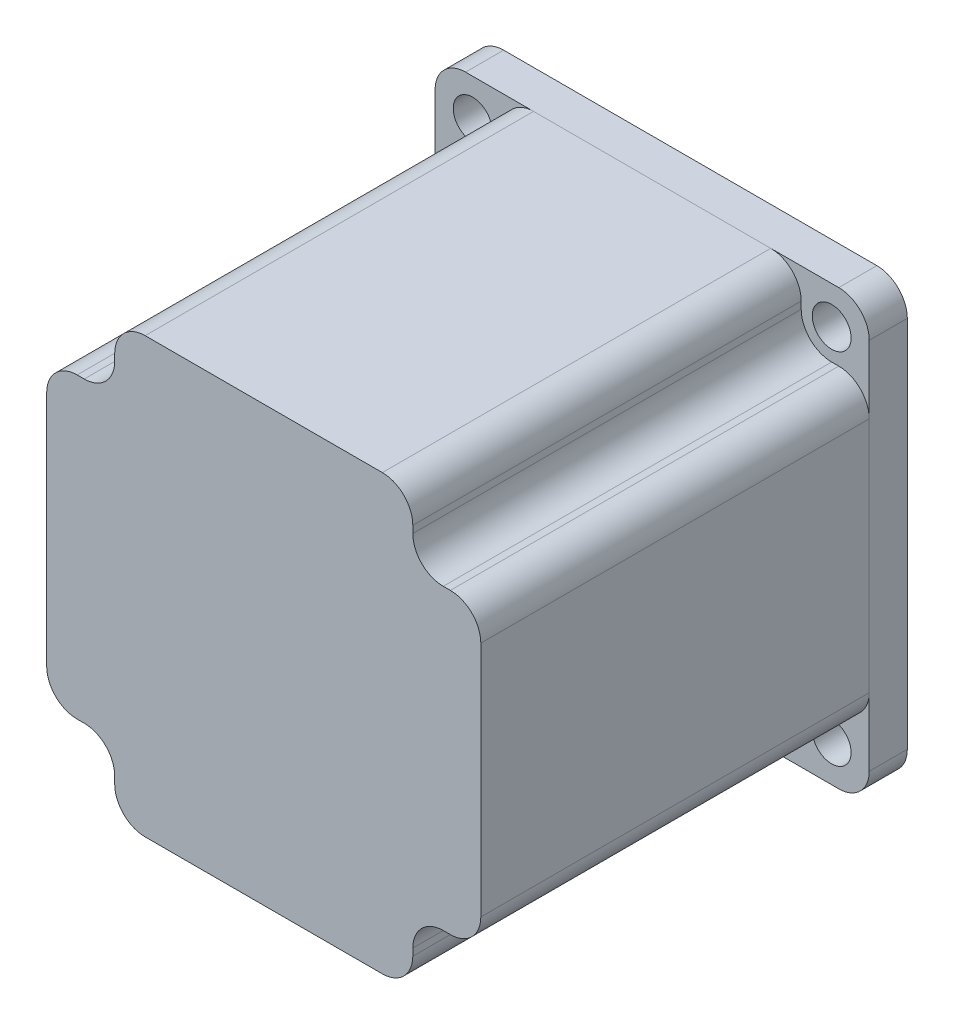
from build123d import *

# Parameters (mm, degrees)
BOSS_EXTRUDE1_DEPTH = 5
BOSS_EXTRUDE2_DEPTH = 51


with BuildPart() as part:
    # Sketch2 → Boss-Extrude1 (new body)
    with BuildSketch(Plane.XY):
        with BuildLine():
            Line((24.5, 28.5), (-24.5, 28.5))
            ThreePointArc((-24.5, 28.5), (-27.328427125, 27.328427125), (-28.5, 24.5))
            Line((-28.5, 24.5), (-28.5, 16.956333897))
            Line((-28.5, 16.956333897), (-28.5, 14.868769462))
            Line((-28.5, 14.868769462), (-28.5, 12.443898331))
            Line((-28.5, 12.443898331), (-28.5, 10.356333897))
            Line((-28.5, 10.356333897), (-28.5, -10.356333897))
            Line((-28.5, -10.356333897), (-28.5, -12.443898331))
            Line((-28.5, -12.443898331), (-28.5, -14.868769462))
            Line((-28.5, -14.868769462), (-28.5, -16.956333897))
            Line((-28.5, -16.956333897), (-28.5, -24.5))
            ThreePointArc((-28.5, -24.5), (-27.328427125, -27.328427125), (-24.5, -28.5))
            Line((-24.5, -28.5), (24.5, -28.5))
            ThreePointArc((24.5, -28.5), (27.328427125, -27.328427125), (28.5, -24.5))
            Line((28.5, -24.5), (28.5, -16.956333897))
            Line((28.5, -16.956333897), (28.5, -14.868769462))
            Line((28.5, -14.868769462), (28.5, -12.443898331))
            Line((28.5, -12.443898331), (28.5, -10.356333897))
            Line((28.5, -10.356333897), (28.5, 10.356333897))
            Line((28.5, 10.356333897), (28.5, 12.443898331))
            Line((28.5, 12.443898331), (28.5, 14.868769462))
            Line((28.5, 14.868769462), (28.5, 16.956333897))
            Line((28.5, 16.956333897), (28.5, 24.5))
            ThreePointArc((28.5, 24.5), (27.328427125, 27.328427125), (24.5, 28.5))
        make_face()
        with BuildLine():
            ThreePointArc((26.12, -23.57), (23.57, -21.02), (21.02, -23.57))
            ThreePointArc((21.02, -23.57), (23.57, -26.12), (26.12, -23.57))
        make_face(mode=Mode.SUBTRACT)
        with BuildLine():
            ThreePointArc((26.12, 23.57), (23.57, 26.12), (21.02, 23.57))
            ThreePointArc((21.02, 23.57), (23.57, 21.02), (26.12, 23.57))
        make_face(mode=Mode.SUBTRACT)
        with BuildLine():
            ThreePointArc((-21.02, 23.57), (-23.57, 26.12), (-26.12, 23.57))
            ThreePointArc((-26.12, 23.57), (-23.57, 21.02), (-21.02, 23.57))
        make_face(mode=Mode.SUBTRACT)
        with BuildLine():
            ThreePointArc((-21.02, -23.57), (-23.57, -21.02), (-26.12, -23.57))
            ThreePointArc((-26.12, -23.57), (-23.57, -26.12), (-21.02, -23.57))
        make_face(mode=Mode.SUBTRACT)
    extrude(amount=-BOSS_EXTRUDE1_DEPTH)


with BuildPart() as body_2:
    # Sketch3 → Boss-Extrude2 (new body)
    with BuildSketch(Plane.XY):
        with BuildLine():
            Line((-15.57, -28.5), (15.57, -28.5))
            ThreePointArc((15.57, -28.5), (18.398427125, -27.328427125), (19.57, -24.5))
            Line((19.57, -24.5), (19.57, -23.57))
            ThreePointArc((19.57, -23.57), (20.741572875, -20.741572875), (23.57, -19.57))
            Line((23.57, -19.57), (24.5, -19.57))
            ThreePointArc((24.5, -19.57), (27.328427125, -18.398427125), (28.5, -15.57))
            Line((28.5, -15.57), (28.5, 15.57))
            ThreePointArc((28.5, 15.57), (27.328427125, 18.398427125), (24.5, 19.57))
            Line((24.5, 19.57), (23.57, 19.57))
            ThreePointArc((23.57, 19.57), (20.741572875, 20.741572875), (19.57, 23.57))
            Line((19.57, 23.57), (19.57, 24.5))
            ThreePointArc((19.57, 24.5), (18.398427125, 27.328427125), (15.57, 28.5))
            Line((15.57, 28.5), (-15.57, 28.5))
            ThreePointArc((-15.57, 28.5), (-18.398427125, 27.328427125), (-19.57, 24.5))
            Line((-19.57, 24.5), (-19.57, 23.57))
            ThreePointArc((-19.57, 23.57), (-20.741572875, 20.741572875), (-23.57, 19.57))
            Line((-23.57, 19.57), (-24.5, 19.57))
            ThreePointArc((-24.5, 19.57), (-27.328427125, 18.398427125), (-28.5, 15.57))
            Line((-28.5, 15.57), (-28.5, -15.57))
            ThreePointArc((-28.5, -15.57), (-27.328427125, -18.398427125), (-24.5, -19.57))
            Line((-24.5, -19.57), (-23.57, -19.57))
            ThreePointArc((-23.57, -19.57), (-20.741572875, -20.741572875), (-19.57, -23.57))
            Line((-19.57, -23.57), (-19.57, -24.5))
            ThreePointArc((-19.57, -24.5), (-18.398427125, -27.328427125), (-15.57, -28.5))
        make_face()
    extrude(amount=BOSS_EXTRUDE2_DEPTH)


solid = Compound([part.part, body_2.part])
